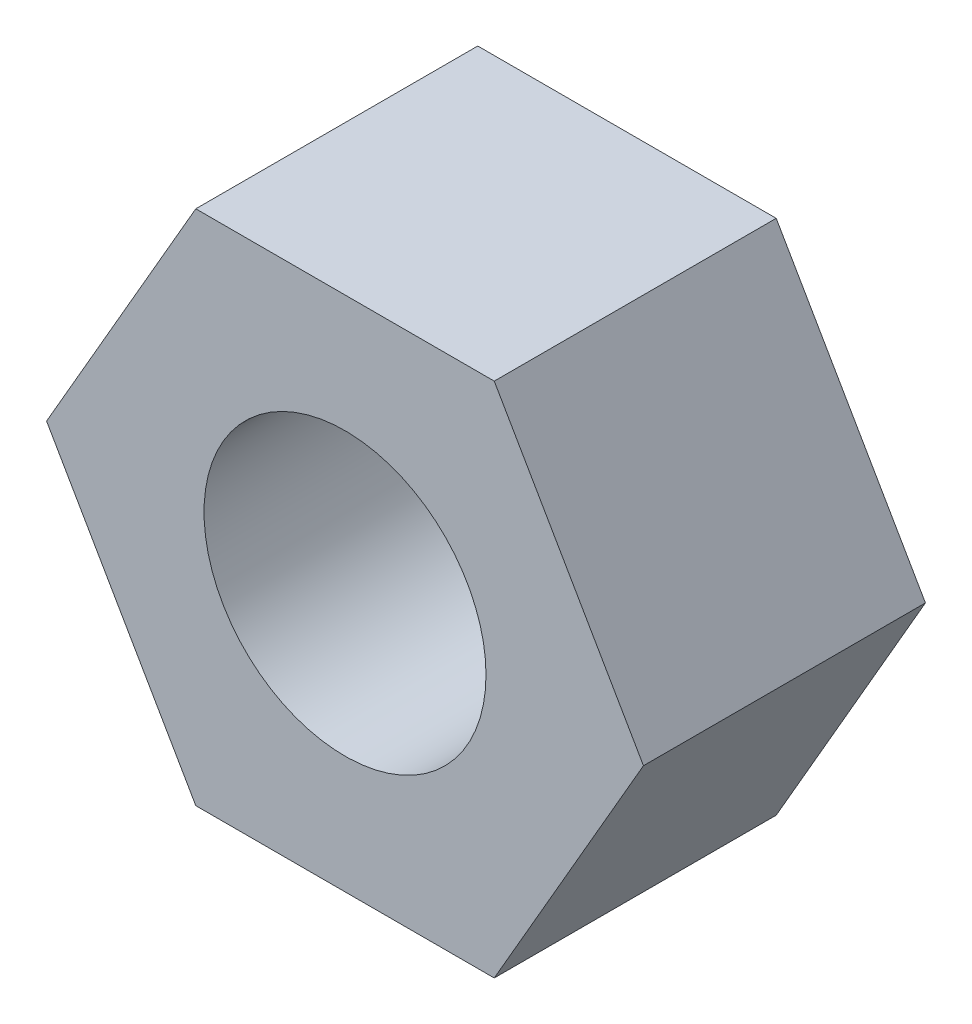
from build123d import *

# Parameters (mm, degrees)
SKETCH1_R           = 1.5
BOSS_EXTRUDE1_DEPTH = 3


with BuildPart() as part:
    # Sketch1 → Boss-Extrude1 (new body)
    with BuildSketch(Plane.XY):
        Polygon((-9.324573519, -45.663872362), (-10.91228676, -42.913872362), (-14.08771324, -42.913872362), (-15.675426481, -45.663872362), (-14.08771324, -48.413872362), (-10.91228676, -48.413872362), align=None)
        with Locations((-12.5, -45.663872362)):
            Circle(SKETCH1_R, mode=Mode.SUBTRACT)
    extrude(amount=BOSS_EXTRUDE1_DEPTH)


solid = part.part
